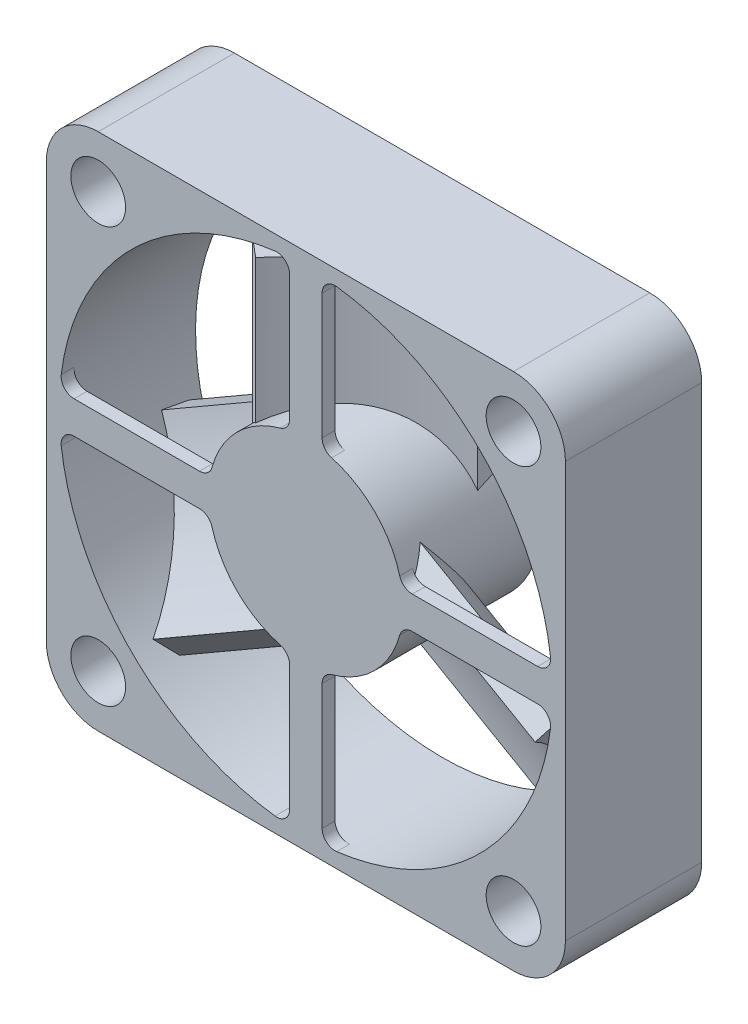
from build123d import *
from build123d.topology import SkipClean

# Parameters (mm, degrees)
SKETCH1_R           = 19
SKETCH1_R_2         = 2.11
BOSS_EXTRUDE1_DEPTH = 10.5
BOSS_EXTRUDE2_START = -1
BOSS_EXTRUDE2_DEPTH = 1
CIRPATTERN1_COUNT   = 4
BOSS_EXTRUDE3_START = 9.5
SKETCH4_R           = 7.5
BOSS_EXTRUDE3_DEPTH = 9.5
EXTRUDE_THIN1_DEPTH = 17
CIRPATTERN2_COUNT   = 3
CUT_EXTRUDE1_DEPTH  = 3.7
CIRPATTERN3_COUNT   = 4


with BuildPart() as part:
    # Sketch1 → Boss-Extrude1 (new body)
    with BuildSketch(Plane.XY):
        with BuildLine():
            Line((-16, 20), (16, 20))
            ThreePointArc((16, 20), (18.828427125, 18.828427125), (20, 16))
            Line((20, 16), (20, -16))
            ThreePointArc((20, -16), (18.828427125, -18.828427125), (16, -20))
            Line((16, -20), (-16, -20))
            ThreePointArc((-16, -20), (-18.828427125, -18.828427125), (-20, -16))
            Line((-20, -16), (-20, 16))
            ThreePointArc((-20, 16), (-18.828427125, 18.828427125), (-16, 20))
        make_face()
        with Locations(Location((0, 0, 0), (0, 0, 180))):
            Circle(SKETCH1_R, mode=Mode.SUBTRACT)
        with Locations(Location((-16, 16, 0), (0, 0, 180))):
            Circle(SKETCH1_R_2, mode=Mode.SUBTRACT)
        with Locations(Location((-16, -16, 0), (0, 0, 180))):
            Circle(SKETCH1_R_2, mode=Mode.SUBTRACT)
        with Locations(Location((16, -16, 0), (0, 0, 180))):
            Circle(SKETCH1_R_2, mode=Mode.SUBTRACT)
        with Locations(Location((16, 16, 0), (0, 0, 180))):
            Circle(SKETCH1_R_2, mode=Mode.SUBTRACT)
    extrude(amount=BOSS_EXTRUDE1_DEPTH)

    # Sketch2 → Boss-Extrude2 (add)
    with BuildSketch(Plane.XY.offset(10.5).offset(BOSS_EXTRUDE2_START)):
        with BuildLine():
            Line((-1.25, 17.85882135), (-1.25, 8.196798155))
            ThreePointArc((-1.25, 8.196798155), (-1.454793774, 7.590459093), (-1.985294118, 7.232468961))
            ThreePointArc((-1.985294118, 7.232468961), (0, -7.5), (1.985294118, 7.232468961))
            ThreePointArc((1.985294118, 7.232468961), (1.454793774, 7.590459093), (1.25, 8.196798155))
            Line((1.25, 8.196798155), (1.25, 17.85882135))
            ThreePointArc((1.25, 17.85882135), (1.588562172, 18.60882135), (2.375, 18.850978091))
            ThreePointArc((2.375, 18.850978091), (0, 19), (-2.375, 18.850978091))
            ThreePointArc((-2.375, 18.850978091), (-1.588562172, 18.60882135), (-1.25, 17.85882135))
        make_face()
    boss_extrude2 = extrude(amount=BOSS_EXTRUDE2_DEPTH)

    # CirPattern1: Boss-Extrude2 ×4 about axis
    cirpattern1_axis = Axis((0, 0, 0), (0, 0, 1))
    for i in range(1, CIRPATTERN1_COUNT):
        add(boss_extrude2.rotate(cirpattern1_axis, i * 360 / CIRPATTERN1_COUNT))

    # Sketch4 → Boss-Extrude3 (add)
    with SkipClean():  # the faces are left unmerged after this step: merging them gives an invalid solid
        with BuildSketch(Plane(origin=(0, 0, 9.5), x_dir=(-1, 0, 0), z_dir=(0, 0, -1)).offset(BOSS_EXTRUDE3_START)):
            with Locations(Location((0, 0, 0), (0, 0, 164.650522983))):
                Circle(SKETCH4_R)
        extrude(amount=-BOSS_EXTRUDE3_DEPTH)

    # Sketch5 → Extrude-Thin1 (add)
    with SkipClean():  # the faces are left unmerged after this step: merging them gives an invalid solid
        with BuildSketch(Plane(origin=(0, 0, 0), x_dir=(1, 0, 0), z_dir=(0, 1, 0))):
            with BuildLine():
                ThreePointArc((-6.073641938, -8.543547558), (-0.600270019, -4.001821599), (6.131264125, -1.705841866))
                Line((6.131264125, -1.705841866), (6.423685209, -3.684348857))
                ThreePointArc((6.423685209, -3.684348857), (0.377258659, -5.746653305), (-4.539056193, -9.826141254))
                Line((-4.539056193, -9.826141254), (-6.073641938, -8.543547558))
            make_face()
        extrude_thin1 = extrude(amount=EXTRUDE_THIN1_DEPTH)

    # CirPattern2: Extrude-Thin1 ×3 about axis
    with SkipClean():  # the faces are left unmerged after this step: merging them gives an invalid solid
        cirpattern2_axis = Axis((0, 0, 0), (0, 0, 1))
        for i in range(1, CIRPATTERN2_COUNT):
            add(extrude_thin1.rotate(cirpattern2_axis, i * 360 / CIRPATTERN2_COUNT))

    # Sketch6 → Cut-Extrude1 (cut)
    with SkipClean():  # the faces are left unmerged after this step: merging them gives an invalid solid
        with BuildSketch(Plane(origin=(0, 0, 0), x_dir=(-1, 0, 0), z_dir=(0, 0, -1))):
            Polygon((-16.896575472, 19.346065215), (-19.346065215, 16.896575472), (-18.449489743, 13.550510257), (-15.103424528, 12.653934785), (-12.653934785, 15.103424528), (-13.550510257, 18.449489743), align=None)
        cut_extrude1 = extrude(amount=-CUT_EXTRUDE1_DEPTH, mode=Mode.SUBTRACT)

    # CirPattern3: Cut-Extrude1 ×4 about axis
    with SkipClean():  # the faces are left unmerged after this step: merging them gives an invalid solid
        cirpattern3_axis = Axis((0, 0, 0), (0, 0, 1))
        for i in range(1, CIRPATTERN3_COUNT):
            add(cut_extrude1.rotate(cirpattern3_axis, i * 360 / CIRPATTERN3_COUNT), mode=Mode.SUBTRACT)


solid = part.part
